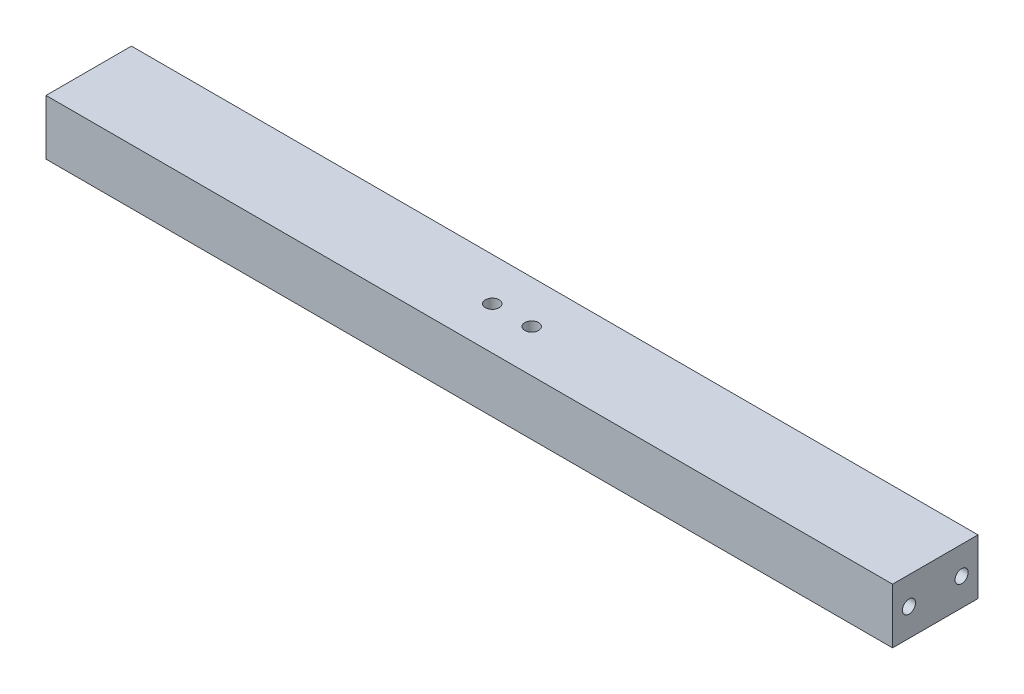
from build123d import *

# Parameters (mm, degrees)
SCHIZZO1_W                   = 644
SCHIZZO1_H                   = 42
ESTRUSIONE_ESTRUSIONE1_DEPTH = 65
SCHIZZO2_W                   = 624
SCHIZZO2_H                   = 55
TAGLIO_ESTRUSIONE1_DEPTH     = 32
SCHIZZO4_R                   = 5.25
TAGLIO_ESTRUSIONE2_DEPTH     = 10
TAGLIO_ESTRUSIONE3_REACH     = 649.613
SCHIZZO5_R                   = 5


with BuildPart() as part:
    # Schizzo1 → Estrusione-Estrusione1 (new body)
    with BuildSketch(Plane.XY):
        Rectangle(SCHIZZO1_W, SCHIZZO1_H)
    extrude(amount=-ESTRUSIONE_ESTRUSIONE1_DEPTH)

    # Schizzo2 → Taglio-Estrusione1 (cut)
    with BuildSketch(Plane.XZ.offset(21)):
        with Locations((0, -32.5)):
            Rectangle(SCHIZZO2_W, SCHIZZO2_H)
    extrude(amount=-TAGLIO_ESTRUSIONE1_DEPTH, mode=Mode.SUBTRACT)

    # Schizzo4 → Taglio-Estrusione2 (cut)
    with BuildSketch(Plane(origin=(0, 21, -21), x_dir=(1, 0, 0), z_dir=(0, -1, 0))):
        with Locations(Location((-15, -11.5, 0), (0, 0, 180))):
            Circle(SCHIZZO4_R)
        with Locations(Location((15, -11.5, 0), (0, 0, 180))):
            Circle(SCHIZZO4_R)
    extrude(amount=TAGLIO_ESTRUSIONE2_DEPTH, mode=Mode.SUBTRACT)

    # Taglio-Estrusione3: up to this face of the body (flat: up to its plane)
    taglio_estrusione3_end = Plane(part.part.faces().sort_by_distance((-322, 0, -32.5))[0])
    # Schizzo5 → Taglio-Estrusione3 (cut, up to the picked face)
    with BuildSketch(Plane(origin=(322, 0, 0), x_dir=(0, 0, -1), z_dir=(1, 0, 0)), mode=Mode.PRIVATE) as taglio_estrusione3_sk1:
        with Locations(Location((12.5, 0, 0), (0, 0, 270))):
            Circle(SCHIZZO5_R)
    taglio_estrusione3_tool1 = split(extrude(taglio_estrusione3_sk1.sketch, amount=-TAGLIO_ESTRUSIONE3_REACH, mode=Mode.PRIVATE), bisect_by=taglio_estrusione3_end, keep=Keep.BOTH, mode=Mode.PRIVATE)
    # Schizzo5 → Taglio-Estrusione3 (cut, up to the picked face)
    with BuildSketch(Plane(origin=(322, 0, 0), x_dir=(0, 0, -1), z_dir=(1, 0, 0)), mode=Mode.PRIVATE) as taglio_estrusione3_sk2:
        with Locations(Location((52.5, 0, 0), (0, 0, 270))):
            Circle(SCHIZZO5_R)
    taglio_estrusione3_tool2 = split(extrude(taglio_estrusione3_sk2.sketch, amount=-TAGLIO_ESTRUSIONE3_REACH, mode=Mode.PRIVATE), bisect_by=taglio_estrusione3_end, keep=Keep.BOTH, mode=Mode.PRIVATE)
    add(taglio_estrusione3_tool1.solids().sort_by(Axis((322, 0, -12.5), (-1, 0, 0)))[0], mode=Mode.SUBTRACT)
    add(taglio_estrusione3_tool2.solids().sort_by(Axis((322, 0, -52.5), (-1, 0, 0)))[0], mode=Mode.SUBTRACT)


solid = part.part
